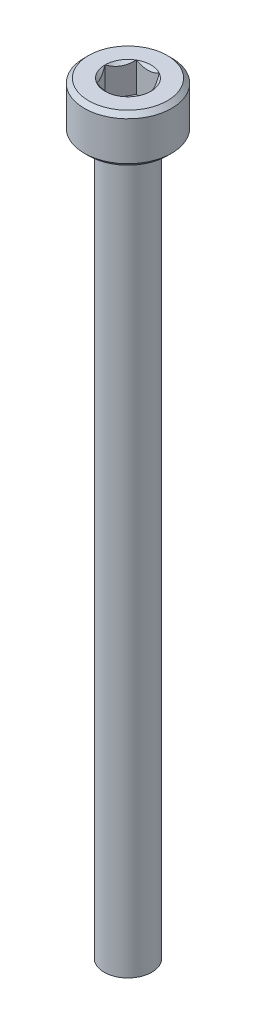
from build123d import *

# Parameters (mm, degrees)
SKETCH1_R           = 2.75
BOSS_EXTRUDE1_DEPTH = 3
CUT_EXTRUDE1_DEPTH  = 1.88
CHAMFER1_SIZE       = 0.275
SKETCH_1_R          = 1.5
EXTRUDE_1_DEPTH     = 45


with BuildPart() as part:
    # Sketch1 → Boss-Extrude1 (new body)
    with BuildSketch(Plane(origin=(0, 0, 0), x_dir=(1, 0, 0), z_dir=(0, 1, 0))):
        with Locations(Location((0, 0, 0), (0, 0, 270))):
            Circle(SKETCH1_R)
    extrude(amount=BOSS_EXTRUDE1_DEPTH)

    # Sketch2 → Cut-Extrude1 (cut)
    with BuildSketch(Plane(origin=(0, 3, 0), x_dir=(1, 0, 0), z_dir=(0, 1, 0))):
        Polygon((0.721687836, 1.25), (-0.721687836, 1.25), (-1.443375673, 0), (-0.721687836, -1.25), (0.721687836, -1.25), (1.443375673, 0), align=None)
    extrude(amount=-CUT_EXTRUDE1_DEPTH, mode=Mode.SUBTRACT)

    # Cut-Extrude2 cone 1 section (through the dimple's axis) → Cut-Extrude2 (revolve, cut)
    with BuildSketch(Plane(origin=(0, 3, 0), x_dir=(0, 0, 1), z_dir=(1, 0, 0))):
        Polygon((0, 0), (1.443375673, 0), (0, 1.443375673), align=None)
    revolve(axis=Axis((0, 3, 0), (0, -1, 0)), mode=Mode.SUBTRACT)

    # Chamfer1
    chamfer1_edges = [part.edges().sort_by_distance(p)[0] for p in [
        (0, 0, -2.75),
        (0, 3, -2.75),
    ]]
    chamfer(chamfer1_edges, length=CHAMFER1_SIZE)

    # 草图1 → 凸台-拉伸1 (add)
    with BuildSketch(Plane(origin=(0, 0, 0), x_dir=(-1, 0, 0), z_dir=(0, -1, 0))):
        with Locations(Location((0, 0, 0), (0, 0, 270))):
            Circle(SKETCH_1_R)
    extrude(amount=EXTRUDE_1_DEPTH)


solid = part.part
